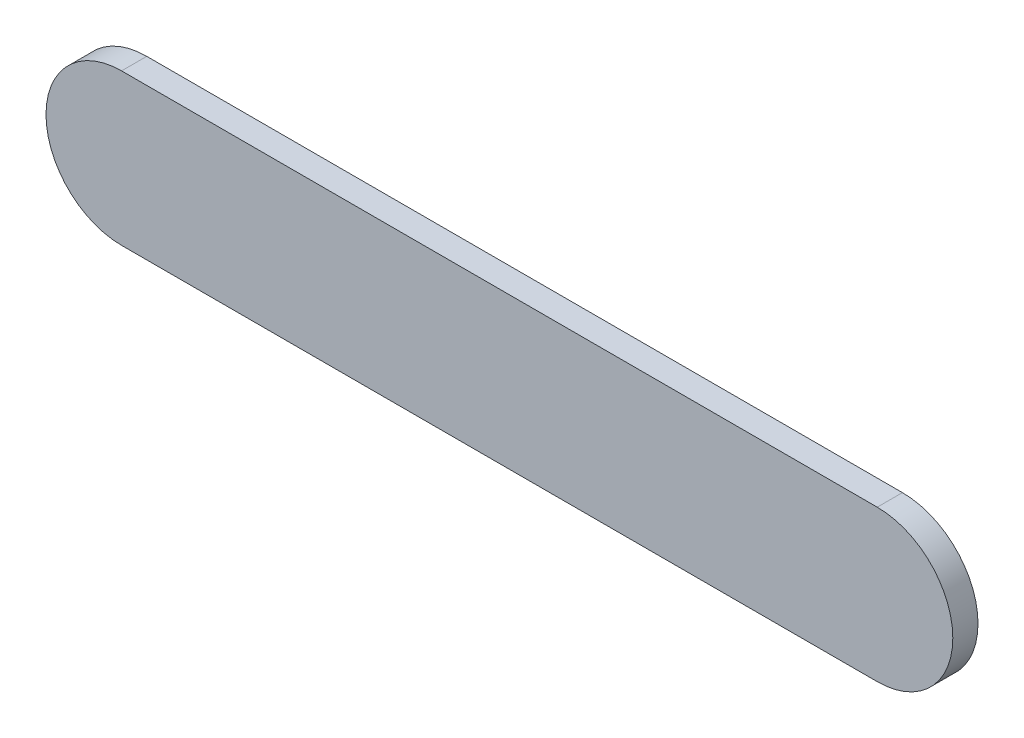
from build123d import *

# Parameters (mm, degrees)
BOSS_EXTRUDE1_DEPTH = 5


with BuildPart() as part:
    # Sketch1 → Boss-Extrude1 (new body)
    with BuildSketch(Plane.XY):
        with BuildLine():
            Line((0, 15), (150, 15))
            ThreePointArc((150, 15), (165, 0), (150, -15))
            Line((150, -15), (0, -15))
            ThreePointArc((0, -15), (-15, 0), (0, 15))
        make_face()
    extrude(amount=BOSS_EXTRUDE1_DEPTH)


solid = part.part
